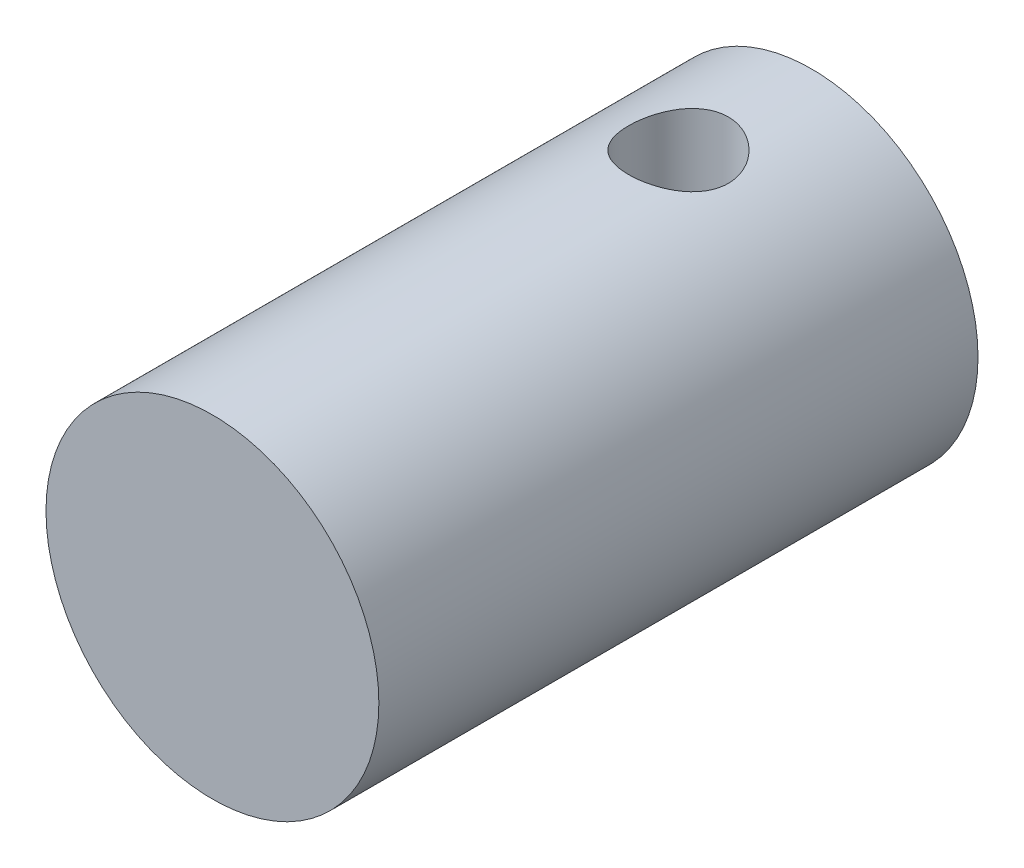
from build123d import *

# Parameters (mm, degrees)
SKETCH1_R           = 25
BOSS_EXTRUDE1_DEPTH = 90
SKETCH2_R           = 7.5
CUT_EXTRUDE2_DEPTH  = 101


with BuildPart() as part:
    # Sketch1 → Boss-Extrude1 (new body)
    with BuildSketch(Plane.XY):
        with Locations(Location((-63.201326803, 37.695746847, 0), (0, 0, 180))):
            Circle(SKETCH1_R)
    extrude(amount=BOSS_EXTRUDE1_DEPTH)

    # Sketch2 → Cut-Extrude2 (cut)
    with BuildSketch(Plane(origin=(0, 0, 0), x_dir=(1, 0, 0), z_dir=(0, 1, 0))):
        with Locations(Location((-63.201326803, -20, 0), (0, 0, 90))):
            Circle(SKETCH2_R)
    extrude(amount=CUT_EXTRUDE2_DEPTH, mode=Mode.SUBTRACT)


solid = part.part
